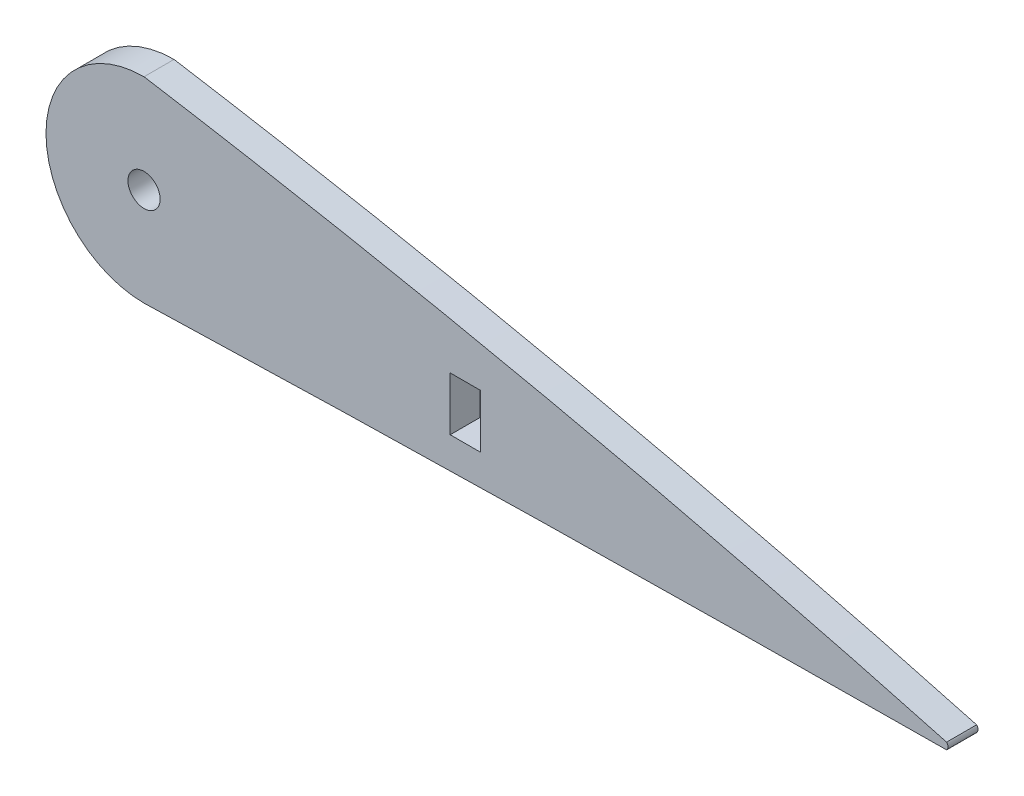
from build123d import *

# Parameters (mm, degrees)
SKETCH_1_R      = 1.5
SKETCH_1_W      = 2.85
SKETCH_1_H      = 5
EXTRUDE_1_DEPTH = 1.4


with BuildPart() as part:
    # Эскиз1 → Бобышка-Вытянуть1 (new, symmetric)
    with BuildSketch(Plane.XY):
        with BuildLine():
            ThreePointArc((175.091334091, 16.644787515), (168.620686799, 13.96455765), (165.940456932, 7.493910359))
            ThreePointArc((165.940456932, 7.493910359), (168.620686797, 1.023263065), (175.091334091, -1.656966802))
            add(Edge.make_bspline(
                [(175.091334091, -1.656966802), (177.330680613, -1.588466601), (181.854695323, -1.455127256), (188.663234462, -1.270383377), (195.516645168, -1.101112884), (202.369532894, -0.948617189), (211.49919029, -0.767742353), (220.603098666, -0.619939742), (229.617630172, -0.50292618), (236.087353854, -0.431514192), (241.980776913, -0.376520461), (246.558970011, -0.339535886), (249.120490965, -0.321271242), (250, -0.315)],
                knots=[0.704401069, 0.704401069, 0.704401069, 0.704401069, 0.730918775, 0.757971338, 0.785017763, 0.812061651, 0.839103366, 0.893099152, 0.919831065, 0.945809917, 0.969680601, 0.989589706, 1, 1, 1, 1], degree=3))
            ThreePointArc((250, -0.315), (250.130477272, 0), (250, 0.315))
            add(Edge.make_bspline(
                [(250, 0.315), (249.15566774, 0.545019818), (246.720175698, 1.208516243), (242.391332083, 2.358339053), (236.849761204, 3.787625364), (230.779918279, 5.298008837), (224.455917947, 6.812866028), (218.030543496, 8.291610632), (211.562405045, 9.719735057), (205.072411509, 11.092374932), (198.567970913, 12.407850726), (192.052369914, 13.665297924), (185.527619973, 14.864093303), (179.872800983, 15.850364437), (176.392239334, 16.431323122), (175.091334091, 16.644787515)],
                knots=[0, 0, 0, 0, 0.0101622, 0.029313053, 0.052011605, 0.076619468, 0.101948061, 0.127526132, 0.153184131, 0.178867888, 0.204557903, 0.230245712, 0.255925967, 0.281594302, 0.296903142, 0.296903142, 0.296903142, 0.296903142], degree=3))
        make_face()
        with Locations((175.091334091, 7.493910357)):
            Circle(SKETCH_1_R, mode=Mode.SUBTRACT)
        with Locations((205.091334091, 4.493910357)):
            Rectangle(SKETCH_1_W, SKETCH_1_H, mode=Mode.SUBTRACT)
    extrude(amount=EXTRUDE_1_DEPTH, both=True)


solid = part.part
